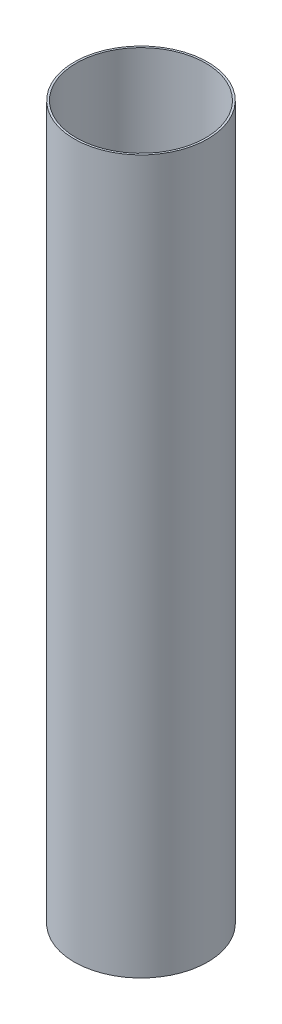
from build123d import *

# Parameters (mm, degrees)
SKETCH1_R           = 39.3
SKETCH1_R_2         = 38.15
BOSS_EXTRUDE1_DEPTH = 420


with BuildPart() as part:
    # Sketch1 → Boss-Extrude1 (new body)
    with BuildSketch(Plane(origin=(0, 0, 0), x_dir=(1, 0, 0), z_dir=(0, 1, 0))):
        with Locations(Location((0, 0, 0), (0, 0, 270))):
            Circle(SKETCH1_R)
        with Locations(Location((0, 0, 0), (0, 0, 270))):
            Circle(SKETCH1_R_2, mode=Mode.SUBTRACT)
    extrude(amount=BOSS_EXTRUDE1_DEPTH)


solid = part.part
